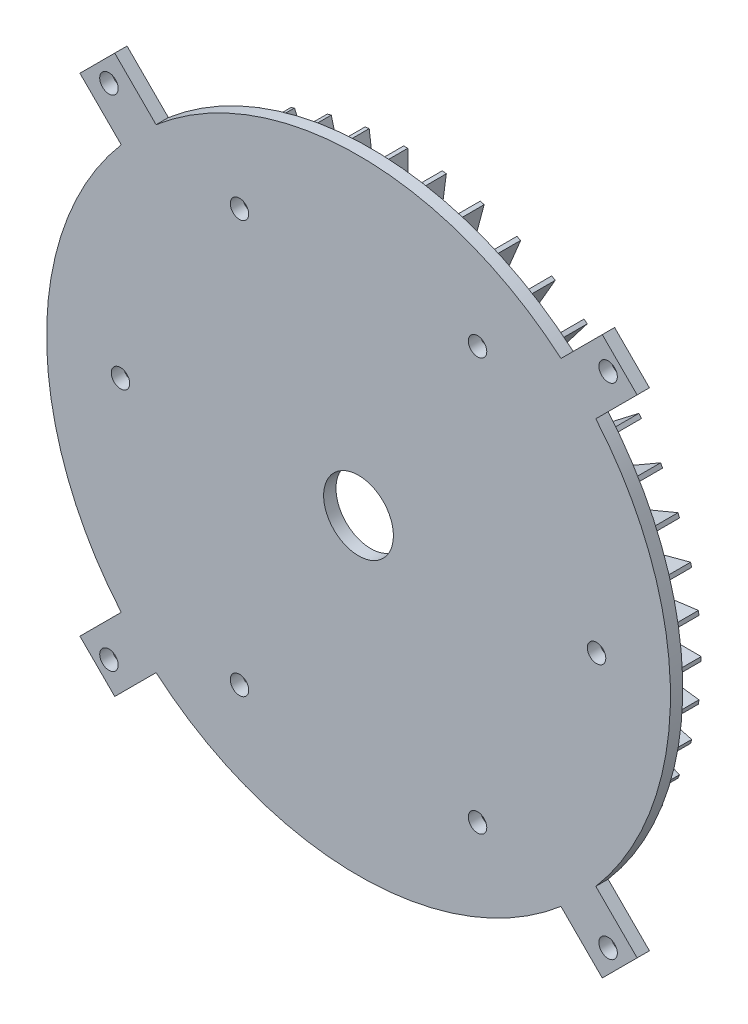
from build123d import *

# Parameters (mm, degrees)
HEAT_SPREADER_START = -35
SKETCH_1_R          = 76
SKETCH_1_R_2        = 8.5
HEAT_SPREADER_DEPTH = 3
TIE_ROD_EARS_START  = -35
TIE_ROD_EARS_DEPTH  = 3
COOLING_FINS_START  = -43.5
SKETCH_3_W          = 46
SKETCH_3_H          = 1
SKETCH_3_W_2        = 1
SKETCH_3_H_2        = 46
COOLING_FINS_DEPTH  = 8.5
SKETCH_4_R          = 2.25
THROUGH_HOLES_DEPTH = 100


with BuildPart() as part:
    # Эскиз1 → Heat_spreader (new body)
    with BuildSketch(Plane.XY.offset(HEAT_SPREADER_START)):
        Circle(SKETCH_1_R)
        Circle(SKETCH_1_R_2, mode=Mode.SUBTRACT)
    extrude(amount=HEAT_SPREADER_DEPTH)

    # Эскиз2 → Tie_rod_ears (add)
    with BuildSketch(Plane.XY.offset(TIE_ROD_EARS_START)):
        Polygon((53.74011537, 45.254833996), (67.882250994, 59.39696962), (59.39696962, 67.882250994), (45.254833996, 53.74011537), align=None)
        Polygon((-45.254833996, 53.74011537), (-59.39696962, 67.882250994), (-67.882250994, 59.39696962), (-53.74011537, 45.254833996), align=None)
        Polygon((-53.74011537, -45.254833996), (-67.882250994, -59.39696962), (-59.39696962, -67.882250994), (-45.254833996, -53.74011537), align=None)
        Polygon((45.254833996, -53.74011537), (59.39696962, -67.882250994), (67.882250994, -59.39696962), (53.74011537, -45.254833996), align=None)
    extrude(amount=TIE_ROD_EARS_DEPTH)

    # Эскиз3 → Cooling_fins (add)
    with BuildSketch(Plane.XY.offset(COOLING_FINS_START)):
        with Locations((49, 0)):
            Rectangle(SKETCH_3_W, SKETCH_3_H)
        Polygon((25.842829492, 2.897958567), (71.449293115, 8.902163409), (71.318766923, 9.893608271), (25.7123033, 3.889403428), align=None)
        Polygon((25.243481006, 6.24633226), (69.676069015, 18.152008334), (69.41724997, 19.117934161), (24.984661961, 7.212258086), align=None)
        Polygon((24.212209561, 9.487829475), (66.710668057, 27.091267364), (66.327984625, 28.015146897), (23.829526129, 10.411709008), align=None)
        Polygon((22.766660498, 12.566987298), (62.603829072, 35.566987298), (62.103829072, 36.433012702), (22.266660498, 13.433012702), align=None)
        Polygon((20.931567562, 15.431120484), (57.425821215, 43.434146218), (56.817059786, 44.227499559), (20.322806133, 16.224473824), align=None)
        Polygon((18.738329701, 18.03122292), (51.265241636, 50.558134855), (50.558134855, 51.265241636), (18.03122292, 18.738329701), align=None)
        Polygon((16.224473824, 20.322806133), (44.227499559, 56.817059786), (43.434146218, 57.425821215), (15.431120484, 20.931567562), align=None)
        Polygon((13.433012702, 22.266660498), (36.433012702, 62.103829072), (35.566987298, 62.603829072), (12.566987298, 22.766660498), align=None)
        Polygon((10.411709008, 23.829526129), (28.015146897, 66.327984625), (27.091267364, 66.710668057), (9.487829475, 24.212209561), align=None)
        Polygon((7.212258086, 24.984661961), (19.117934161, 69.41724997), (18.152008334, 69.676069015), (6.24633226, 25.243481006), align=None)
        Polygon((3.889403428, 25.7123033), (9.893608271, 71.318766923), (8.902163409, 71.449293115), (2.897958567, 25.842829492), align=None)
        with Locations((0, 49)):
            Rectangle(SKETCH_3_W_2, SKETCH_3_H_2)
        Polygon((-2.897958567, 25.842829492), (-8.902163409, 71.449293115), (-9.893608271, 71.318766923), (-3.889403428, 25.7123033), align=None)
        Polygon((-6.24633226, 25.243481006), (-18.152008334, 69.676069015), (-19.117934161, 69.41724997), (-7.212258086, 24.984661961), align=None)
        Polygon((-9.487829475, 24.212209561), (-27.091267364, 66.710668057), (-28.015146897, 66.327984625), (-10.411709008, 23.829526129), align=None)
        Polygon((-12.566987298, 22.766660498), (-35.566987298, 62.603829072), (-36.433012702, 62.103829072), (-13.433012702, 22.266660498), align=None)
        Polygon((-15.431120484, 20.931567562), (-43.434146218, 57.425821215), (-44.227499559, 56.817059786), (-16.224473824, 20.322806133), align=None)
        Polygon((-18.03122292, 18.738329701), (-50.558134855, 51.265241636), (-51.265241636, 50.558134855), (-18.738329701, 18.03122292), align=None)
        Polygon((-20.322806133, 16.224473824), (-56.817059786, 44.227499559), (-57.425821215, 43.434146218), (-20.931567562, 15.431120484), align=None)
        Polygon((-22.266660498, 13.433012702), (-62.103829072, 36.433012702), (-62.603829072, 35.566987298), (-22.766660498, 12.566987298), align=None)
        Polygon((-23.829526129, 10.411709008), (-66.327984625, 28.015146897), (-66.710668057, 27.091267364), (-24.212209561, 9.487829475), align=None)
        Polygon((-24.984661961, 7.212258086), (-69.41724997, 19.117934161), (-69.676069015, 18.152008334), (-25.243481006, 6.24633226), align=None)
        Polygon((-25.7123033, 3.889403428), (-71.318766923, 9.893608271), (-71.449293115, 8.902163409), (-25.842829492, 2.897958567), align=None)
        with Locations((-49, 0)):
            Rectangle(SKETCH_3_W, SKETCH_3_H)
        Polygon((-25.842829492, -2.897958567), (-71.449293115, -8.902163409), (-71.318766923, -9.893608271), (-25.7123033, -3.889403428), align=None)
        Polygon((-25.243481006, -6.24633226), (-69.676069015, -18.152008334), (-69.41724997, -19.117934161), (-24.984661961, -7.212258086), align=None)
        Polygon((-24.212209561, -9.487829475), (-66.710668057, -27.091267364), (-66.327984625, -28.015146897), (-23.829526129, -10.411709008), align=None)
        Polygon((-22.766660498, -12.566987298), (-62.603829072, -35.566987298), (-62.103829072, -36.433012702), (-22.266660498, -13.433012702), align=None)
        Polygon((-20.931567562, -15.431120484), (-57.425821215, -43.434146218), (-56.817059786, -44.227499559), (-20.322806133, -16.224473824), align=None)
        Polygon((-18.738329701, -18.03122292), (-51.265241636, -50.558134855), (-50.558134855, -51.265241636), (-18.03122292, -18.738329701), align=None)
        Polygon((-16.224473824, -20.322806133), (-44.227499559, -56.817059786), (-43.434146218, -57.425821215), (-15.431120484, -20.931567562), align=None)
        Polygon((-13.433012702, -22.266660498), (-36.433012702, -62.103829072), (-35.566987298, -62.603829072), (-12.566987298, -22.766660498), align=None)
        Polygon((-10.411709008, -23.829526129), (-28.015146897, -66.327984625), (-27.091267364, -66.710668057), (-9.487829475, -24.212209561), align=None)
        Polygon((-7.212258086, -24.984661961), (-19.117934161, -69.41724997), (-18.152008334, -69.676069015), (-6.24633226, -25.243481006), align=None)
        Polygon((-3.889403428, -25.7123033), (-9.893608271, -71.318766923), (-8.902163409, -71.449293115), (-2.897958567, -25.842829492), align=None)
        with Locations((0, -49)):
            Rectangle(SKETCH_3_W_2, SKETCH_3_H_2)
        Polygon((2.897958567, -25.842829492), (8.902163409, -71.449293115), (9.893608271, -71.318766923), (3.889403428, -25.7123033), align=None)
        Polygon((6.24633226, -25.243481006), (18.152008334, -69.676069015), (19.117934161, -69.41724997), (7.212258086, -24.984661961), align=None)
        Polygon((9.487829475, -24.212209561), (27.091267364, -66.710668057), (28.015146897, -66.327984625), (10.411709008, -23.829526129), align=None)
        Polygon((12.566987298, -22.766660498), (35.566987298, -62.603829072), (36.433012702, -62.103829072), (13.433012702, -22.266660498), align=None)
        Polygon((15.431120484, -20.931567562), (43.434146218, -57.425821215), (44.227499559, -56.817059786), (16.224473824, -20.322806133), align=None)
        Polygon((18.03122292, -18.738329701), (50.558134855, -51.265241636), (51.265241636, -50.558134855), (18.738329701, -18.03122292), align=None)
        Polygon((20.322806133, -16.224473824), (56.817059786, -44.227499559), (57.425821215, -43.434146218), (20.931567562, -15.431120484), align=None)
        Polygon((22.266660498, -13.433012702), (62.103829072, -36.433012702), (62.603829072, -35.566987298), (22.766660498, -12.566987298), align=None)
        Polygon((23.829526129, -10.411709008), (66.327984625, -28.015146897), (66.710668057, -27.091267364), (24.212209561, -9.487829475), align=None)
        Polygon((24.984661961, -7.212258086), (69.41724997, -19.117934161), (69.676069015, -18.152008334), (25.243481006, -6.24633226), align=None)
        Polygon((25.7123033, -3.889403428), (71.318766923, -9.893608271), (71.449293115, -8.902163409), (25.842829492, -2.897958567), align=None)
    extrude(amount=COOLING_FINS_DEPTH)

    # Эскиз4 → Through_holes (cut, symmetric)
    with BuildSketch(Plane.XY):
        with Locations((60.811183182, 60.811183182)):
            Circle(SKETCH_4_R)
        with Locations((-60.811183182, 60.811183182)):
            Circle(SKETCH_4_R)
        with Locations((-60.811183182, -60.811183182)):
            Circle(SKETCH_4_R)
        with Locations((60.811183182, -60.811183182)):
            Circle(SKETCH_4_R)
        with Locations((58, 0)):
            Circle(SKETCH_4_R)
        with Locations((29, 50.229473419)):
            Circle(SKETCH_4_R)
        with Locations((-29, 50.229473419)):
            Circle(SKETCH_4_R)
        with Locations((-58, 0)):
            Circle(SKETCH_4_R)
        with Locations((-29, -50.229473419)):
            Circle(SKETCH_4_R)
        with Locations((29, -50.229473419)):
            Circle(SKETCH_4_R)
    extrude(amount=THROUGH_HOLES_DEPTH, both=True, mode=Mode.SUBTRACT)


solid = part.part
